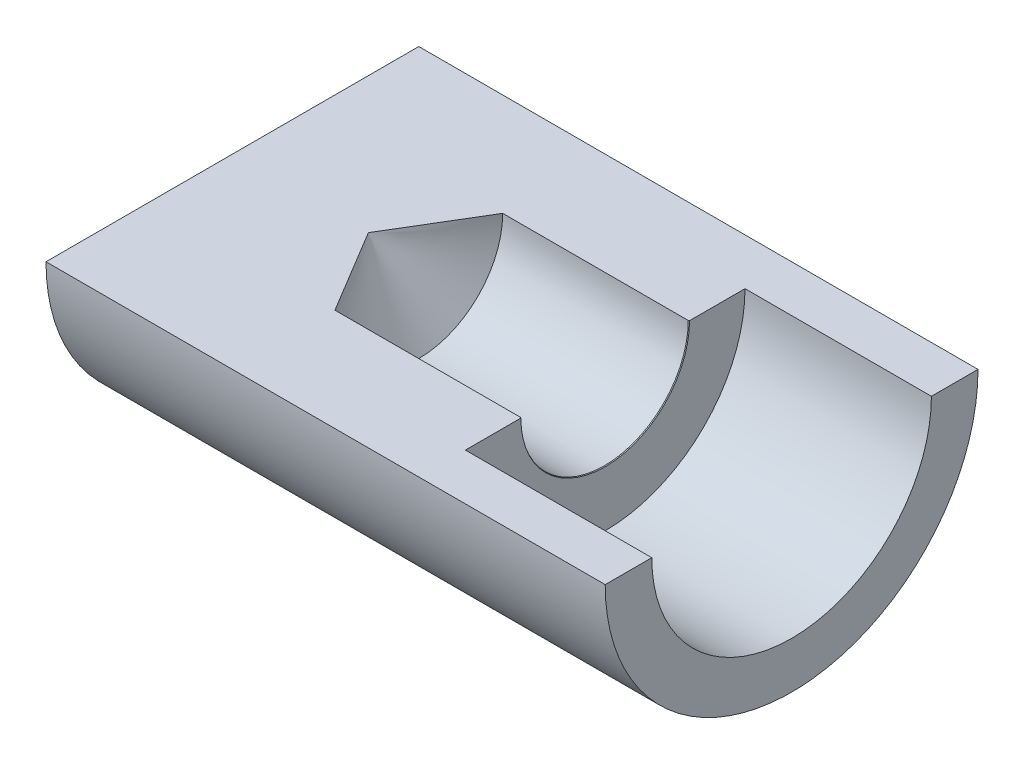
from build123d import *

# Parameters (mm, degrees)
ESQUISSE1_W             = 30
ESQUISSE1_H             = 10
ESQUISSE3_W             = 32
ESQUISSE3_H             = 12
ENL_V_MAT_EXTRU_1_DEPTH = 34.166247904


with BuildPart() as part:
    # Esquisse1 → Révolution2 (revolve)
    with BuildSketch(Plane.XY, mode=Mode.PRIVATE) as r_volution2_sk:
        with Locations((15, 5)):
            Rectangle(ESQUISSE1_W, ESQUISSE1_H)
    revolve(r_volution2_sk.sketch.rotate(Axis((0, 0, 0), (1, 0, 0)), 90), axis=Axis((0, 0, 0), (1, 0, 0)))

    # Esquisse2 → Chambrage pour vis à tête hexagonale M81 (revolve, cut)
    with BuildSketch(Plane(origin=(30, 0, 0), x_dir=(0, 0, -1), z_dir=(0, 1, 0))):
        Polygon((0, 0), (0, 22.703872786), (4.5, 20), (4.5, 10.04330127), (4.525, 10), (7.5, 10), (7.5, 0), align=None)
    revolve(axis=Axis((36.35, 0, 0), (-1, 0, 0)), mode=Mode.SUBTRACT)

    # Esquisse3 → Enlèv. mat.-Extru.1 (cut, through all)
    with BuildSketch(Plane(origin=(30, 0, 0), x_dir=(0, 0, -1), z_dir=(1, 0, 0))):
        with Locations((-0.50912904, 6)):
            Rectangle(ESQUISSE3_W, ESQUISSE3_H)
    extrude(amount=-ENL_V_MAT_EXTRU_1_DEPTH, mode=Mode.SUBTRACT)


solid = part.part
